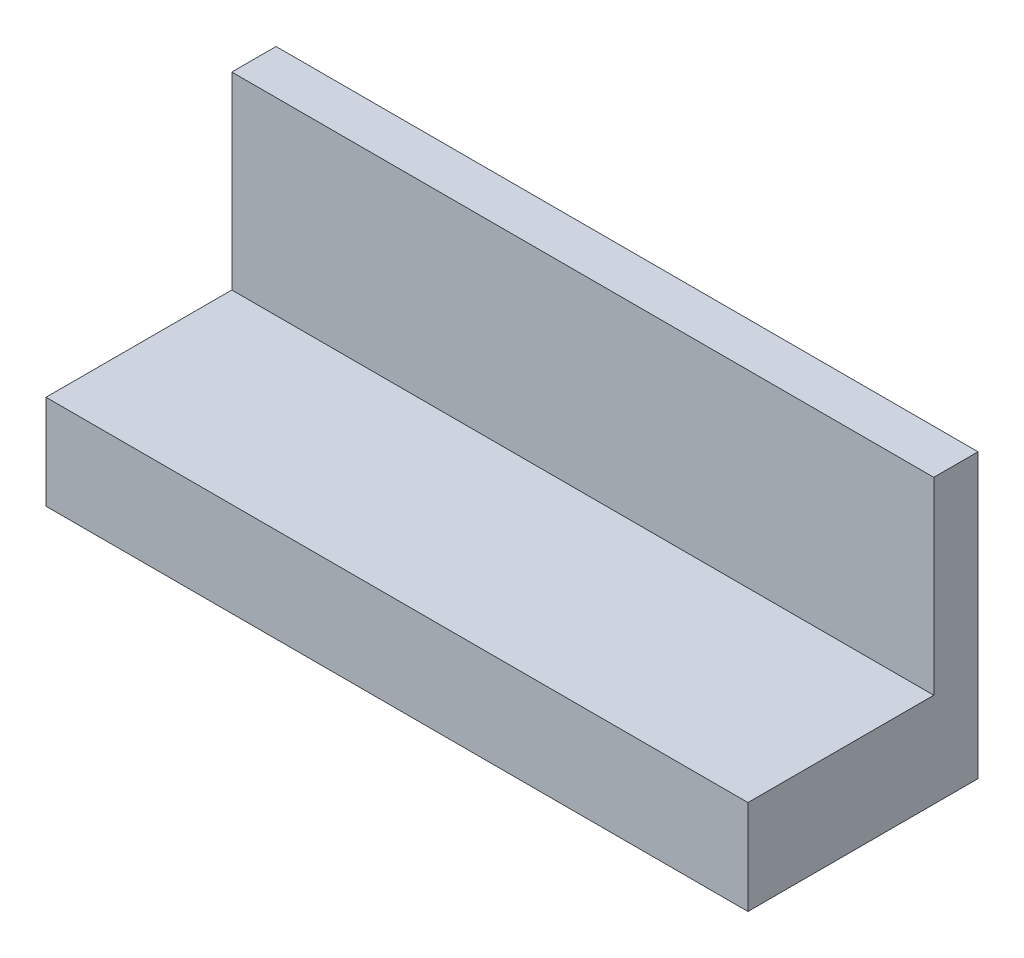
from build123d import *

# Parameters (mm, degrees)
SKETCH1_W           = 23.8
SKETCH1_H           = 3.2
BOSS_EXTRUDE1_DEPTH = 7.8
SHELL1_T            = -1.2
SKETCH3_R           = 1.5
SKETCH3_R_2         = 0.6
BOSS_EXTRUDE3_DEPTH = 1.8
LPATTERN1_COUNT     = 2
LPATTERN1_PITCH     = 8
BOSS_EXTRUDE4_DEPTH = 1.5


with BuildPart() as part:
    # Sketch1 → Boss-Extrude1 (new body)
    with BuildSketch(Plane.XY):
        with Locations((11.9, 1.6)):
            Rectangle(SKETCH1_W, SKETCH1_H)
    extrude(amount=-BOSS_EXTRUDE1_DEPTH)

    # Shell1
    shell1_openings = [part.faces().sort_by_distance(p)[0] for p in [
        (11.9, 0, -3.9),
    ]]
    offset(amount=SHELL1_T, openings=shell1_openings, kind=Kind.INTERSECTION)

    # Sketch3 → Boss-Extrude3 (add)
    with BuildSketch(Plane.XZ.offset(-2)):
        with Locations(Location((15.9, -3.9, 0), (0, 0, 90))):
            Circle(SKETCH3_R)
        with Locations(Location((15.9, -3.9, 0), (0, 0, 270))):
            Circle(SKETCH3_R_2, mode=Mode.SUBTRACT)
    boss_extrude3 = extrude(amount=BOSS_EXTRUDE3_DEPTH)

    # LPattern1: Boss-Extrude3 ×2
    with Locations(*[(-i * LPATTERN1_PITCH, 0, 0) for i in range(1, LPATTERN1_COUNT)]):
        add(boss_extrude3)

    # Sketch4 → Boss-Extrude4 (add)
    with BuildSketch(Plane(origin=(0, 0, -7.8), x_dir=(-1, 0, 0), z_dir=(0, 0, -1))):
        Polygon((-23.8, 3.2), (-23.8, 9.6), (0, 9.6), (0, 3.2), (0, 0), (-23.8, 0), align=None)
    extrude(amount=-BOSS_EXTRUDE4_DEPTH)


solid = part.part
